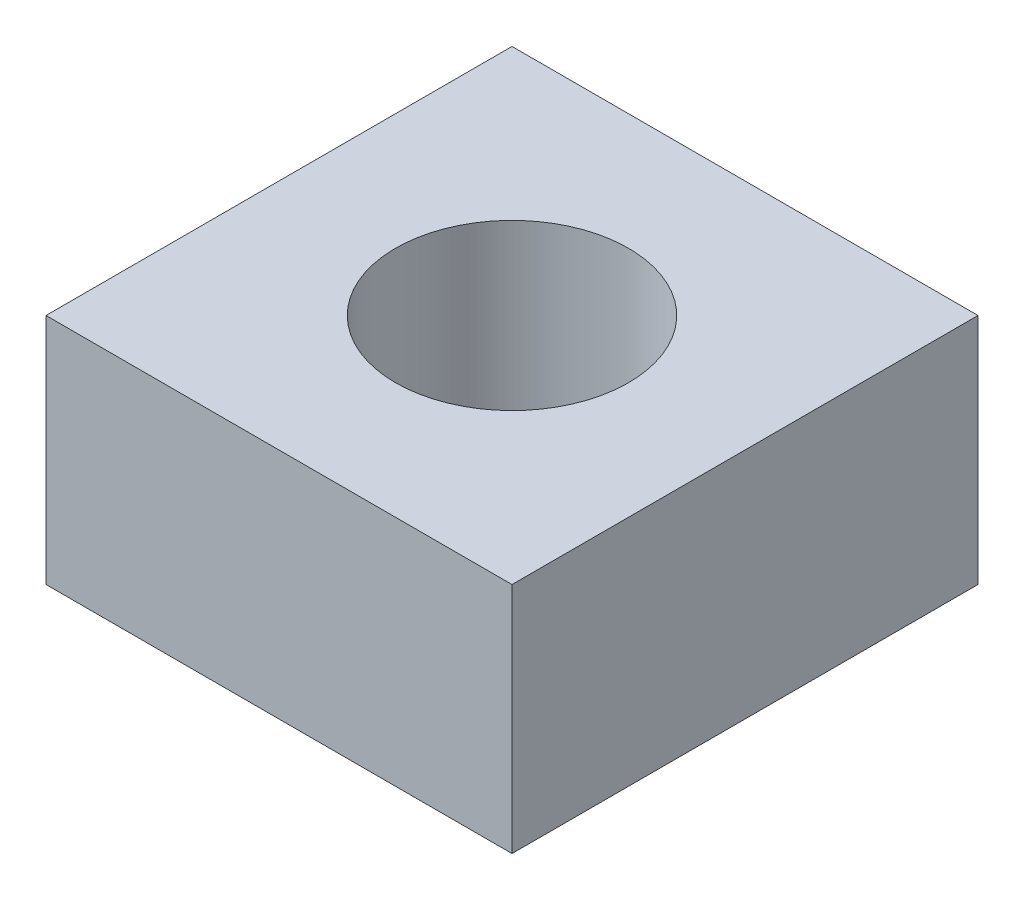
from build123d import *

# Parameters (mm, degrees)
SKETCH1_W           = 6
SKETCH1_H           = 6
BOSS_EXTRUDE1_DEPTH = 3
SKETCH2_R           = 1.5
CUT_EXTRUDE1_DEPTH  = 6.196152423


with BuildPart() as part:
    # Sketch1 → Boss-Extrude1 (new body)
    with BuildSketch(Plane(origin=(0, 0, 0), x_dir=(1, 0, 0), z_dir=(0, 1, 0))):
        Rectangle(SKETCH1_W, SKETCH1_H)
    extrude(amount=BOSS_EXTRUDE1_DEPTH)

    # Sketch2 → Cut-Extrude1 (cut, through all)
    with BuildSketch(Plane(origin=(0, 3, 0), x_dir=(-1, 0, 0), z_dir=(0, 1, 0))):
        with Locations(Location((0, 0, 0), (0, 0, 90))):
            Circle(SKETCH2_R)
    extrude(amount=-CUT_EXTRUDE1_DEPTH, mode=Mode.SUBTRACT)


solid = part.part
